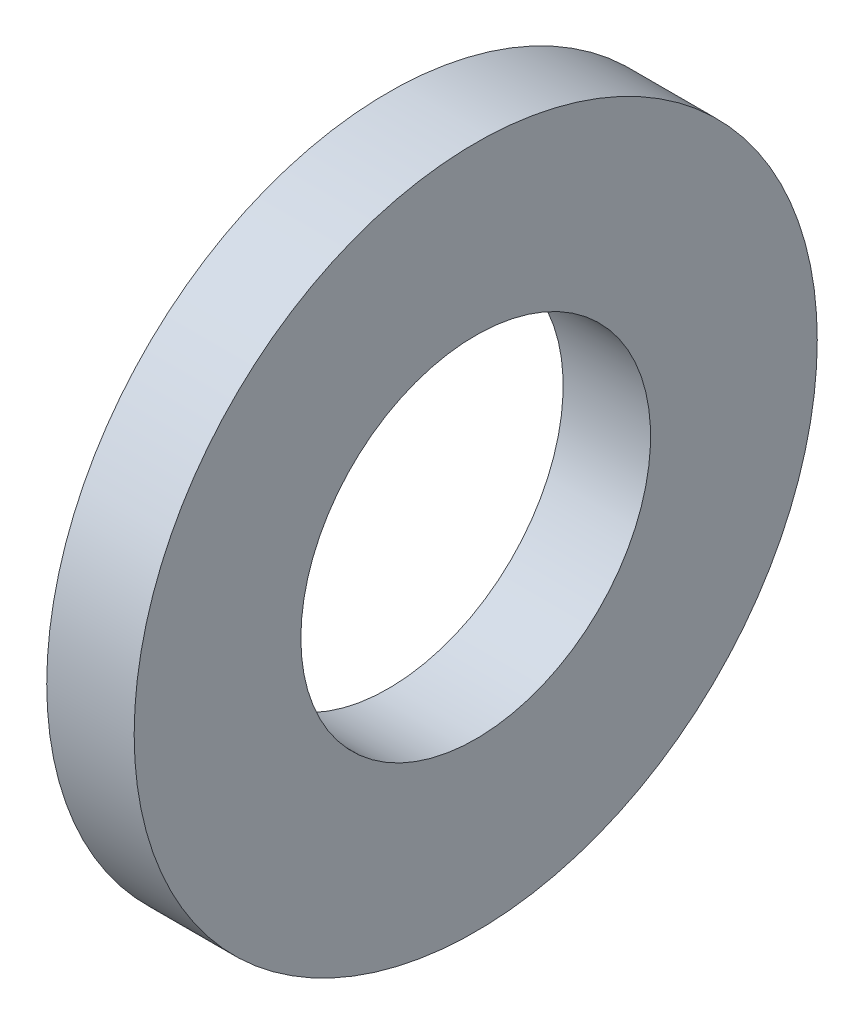
from build123d import *

# Parameters (mm, degrees)
SKETCH1_W = 1.6
SKETCH1_H = 3.05


with BuildPart() as part:
    # Sketch1 → Base-Revolve (revolve)
    with BuildSketch(Plane.XY, mode=Mode.PRIVATE) as base_revolve_sk:
        with Locations((-0.8, 4.725)):
            Rectangle(SKETCH1_W, SKETCH1_H)
    revolve(base_revolve_sk.sketch.rotate(Axis((-34.925, 0, 0), (1, 0, 0)), 90), axis=Axis((-34.925, 0, 0), (1, 0, 0)))


solid = part.part
